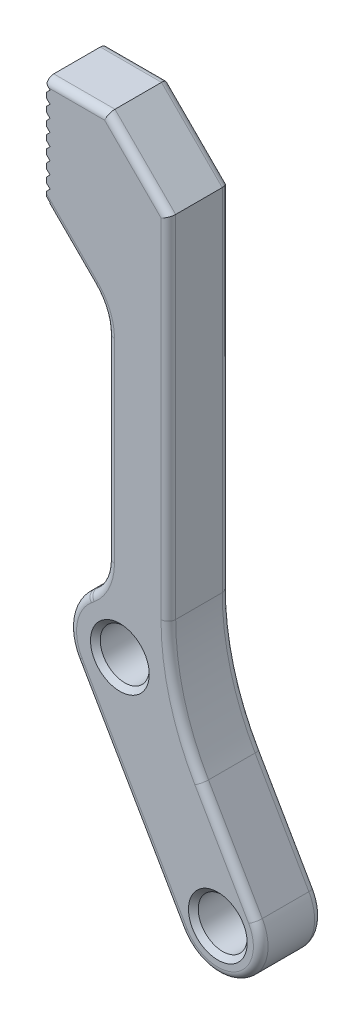
from build123d import *

# Parameters (mm, degrees)
IZIM1_R                     = 10
Y_KSEKLIK_EKSTR_ZYON1_DEPTH = 25
RADYUS1_R                   = 20
RADYUS2_R                   = 100
PAH1_SIZE                   = 2
KES_EKSTR_ZYON1_DEPTH       = 276.643654753
KES_EKSTR_ZYON1_DEPTH_BACK  = 276.643654753
RADYUS3_R                   = 3


with BuildPart() as part:
    # Çizim1 → Yükseklik-Ekstrüzyon1 (new body)
    with BuildSketch(Plane.XY):
        with BuildLine():
            Line((-37.396370289, 12.396370289), (-12.396370289, 12.396370289))
            Line((-12.396370289, 12.396370289), (12.396370289, -12.396370289))
            Line((12.396370289, -12.396370289), (12.396370289, -182.396370289))
            Line((12.396370289, -182.396370289), (47.759074277, -243.646370289))
            ThreePointArc((47.759074277, -243.646370289), (41.353629711, -267.551814855), (17.448185145, -261.146370289))
            Line((17.448185145, -261.146370289), (-33.791651246, -172.396370289))
            Line((-33.791651246, -172.396370289), (-12.603629711, -154.617509234))
            Line((-12.603629711, -154.617509234), (-12.603629711, -57.396370289))
            Line((-12.603629711, -57.396370289), (-37.396370289, -32.603629711))
            Line((-37.396370289, -32.603629711), (-37.396370289, 12.396370289))
        make_face()
        with Locations((-7.396370289, -177.396370289)):
            Circle(IZIM1_R, mode=Mode.SUBTRACT)
        with Locations((32.603629711, -252.396370289)):
            Circle(IZIM1_R, mode=Mode.SUBTRACT)
    extrude(amount=Y_KSEKLIK_EKSTR_ZYON1_DEPTH)

    # Radyus1
    radyus1_edges = [part.edges().sort_by_distance(p)[0] for p in [
        (-33.791651246, -172.396370289, 12.5),
        (-12.603629711, -154.617509234, 12.5),
        (-12.603629711, -57.396370289, 12.5),
    ]]
    fillet(radyus1_edges, radius=RADYUS1_R)

    # Radyus2
    radyus2_edges = [part.edges().sort_by_distance(p)[0] for p in [
        (12.396370289, -182.396370289, 12.5),
    ]]
    fillet(radyus2_edges, radius=RADYUS2_R)

    # Pah1
    pah1_edges = [part.edges().sort_by_distance(p)[0] for p in [
        (-17.396370289, -177.396370289, 0),
        (-17.396370289, -177.396370289, 25),
        (22.603629711, -252.396370289, 0),
        (22.603629711, -252.396370289, 25),
    ]]
    chamfer(pah1_edges, length=PAH1_SIZE)

    # Çizim2 → Kes-Ekstrüzyon1 (cut, two sides: drawn at the far end of the back side and taken through both)
    with BuildSketch(Plane(origin=(0, 0, 0), x_dir=(-1, 0, 0), z_dir=(0, 0, -1)).offset(-KES_EKSTR_ZYON1_DEPTH_BACK)):
        Polygon((37.396370289, 12.396370289), (37.396370289, 10.396370289), (35.896370289, 8.896370289), (37.396370289, 7.396370289), (37.396370289, 5.396370289), (35.896370289, 3.896370289), (37.396370289, 2.396370289), (37.396370289, 0.396370289), (35.896370289, -1.103629711), (37.396370289, -2.603629711), (37.396370289, -4.603629711), (35.896370289, -6.103629711), (37.396370289, -7.603629711), (37.396370289, -9.603629711), (35.896370289, -11.103629711), (37.396370289, -12.603629711), (37.396370289, -14.603629711), (35.896370289, -16.103629711), (37.396370289, -17.603629711), (37.396370289, -19.603629711), (35.896370289, -21.103629711), (37.396370289, -22.603629711), (37.396370289, -24.603629711), (35.896370289, -26.103629711), (37.396370289, -27.603629711), (37.396370289, -29.603629711), (35.896370289, -31.103629711), (37.396370289, -32.603629711), (40.97255524, -32.603629711), (40.97255524, 12.396370289), align=None)
    extrude(amount=KES_EKSTR_ZYON1_DEPTH + KES_EKSTR_ZYON1_DEPTH_BACK, mode=Mode.SUBTRACT)

    # Radyus3
    radyus3_edges = [part.edges().sort_by_distance(p)[0] for p in [
        (-27.928932188, -42.071067812, 25),
        (-14.126039061, -58.026972889, 25),
        (-12.603629711, -105.485998804, 25),
        (-14.47747397, -153.743721305, 25),
        (-20.341888285, -161.110679149, 25),
        (-27.776301919, -173.457038674, 25),
        (-3.976234895, -224.038186258, 25),
        (41.353629711, -267.551814855, 25),
        (36.776452094, -224.623910668, 25),
        (15.80378766, -181.483355556, 25),
        (-27.928932188, -42.071067812, 0),
        (-14.126039061, -58.026972889, 0),
        (-12.603629711, -105.485998804, 0),
        (-14.47747397, -153.743721305, 0),
        (-20.341888285, -161.110679149, 0),
        (-27.776301919, -173.457038674, 0),
        (-3.976234895, -224.038186258, 0),
        (41.353629711, -267.551814855, 0),
        (36.776452094, -224.623910668, 0),
        (15.80378766, -181.483355556, 0),
        (12.396370289, -83.998910668, 25),
        (0, 0, 25),
        (-24.896370289, 12.396370289, 25),
        (-24.896370289, 12.396370289, 0),
        (12.396370289, -83.998910668, 0),
        (0, 0, 0),
    ]]
    fillet(radyus3_edges, radius=RADYUS3_R)


solid = part.part
